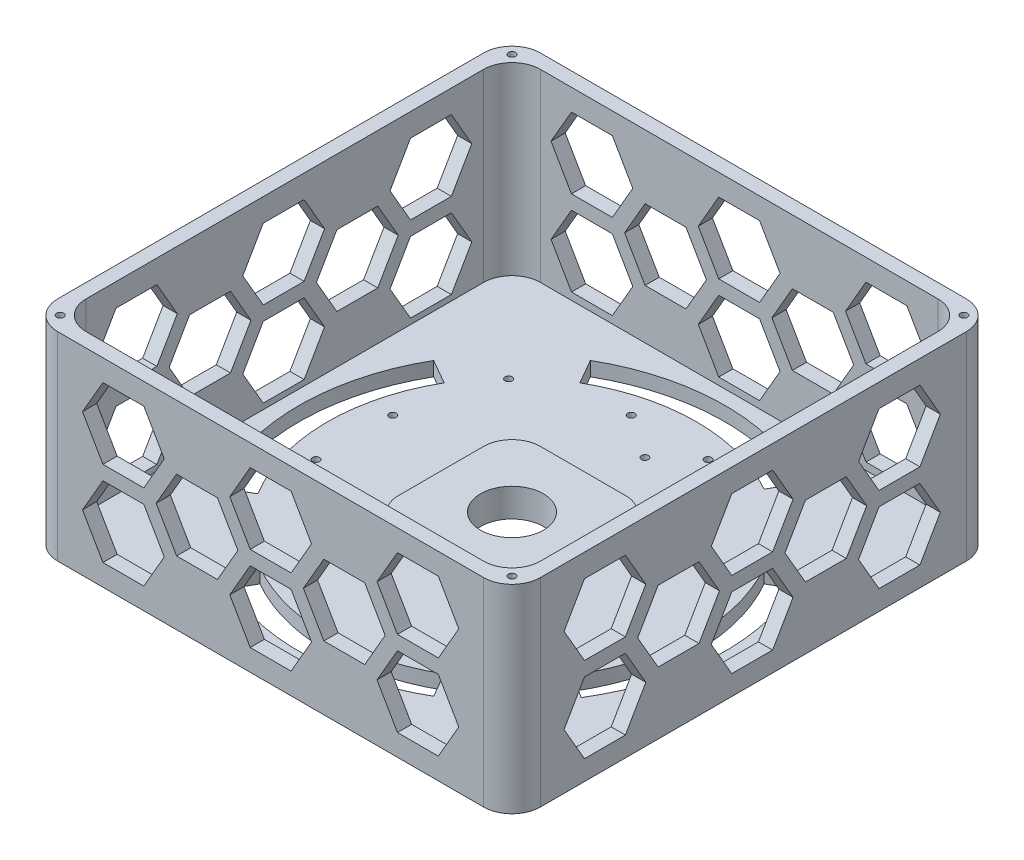
from build123d import *

# Parameters (mm, degrees)
BOSS_EXTRUDE1_DEPTH = 70
CUT_EXTRUDE1_DEPTH  = 65
CUT_EXTRUDE2_DEPTH  = 195
CUT_EXTRUDE4_REACH  = 252.4
LPATTERN1_COUNT     = 2
LPATTERN1_PITCH     = 50
BOSS_EXTRUDE3_DEPTH = 5
CUT_EXTRUDE5_REACH  = 249.79
SKETCH15_R          = 11.1
SKETCH16_R          = 1.25
CUT_EXTRUDE6_DEPTH  = 12
SKETCH17_R          = 1.25
CUT_EXTRUDE7_DEPTH  = 4.5


with BuildPart() as part:
    # Sketch1 → Boss-Extrude1 (new body)
    with BuildSketch(Plane(origin=(0, 0, 0), x_dir=(1, 0, 0), z_dir=(0, 1, 0))):
        with BuildLine():
            Line((10, 0), (160, 0))
            ThreePointArc((160, 0), (167.071067812, 2.928932188), (170, 10))
            Line((170, 10), (170, 160))
            ThreePointArc((170, 160), (167.071067812, 167.071067812), (160, 170))
            Line((160, 170), (10, 170))
            ThreePointArc((10, 170), (2.928932188, 167.071067812), (0, 160))
            Line((0, 160), (0, 10))
            ThreePointArc((0, 10), (2.928932188, 2.928932188), (10, 0))
        make_face()
    extrude(amount=BOSS_EXTRUDE1_DEPTH)

    # Sketch2 → Cut-Extrude1 (cut)
    with BuildSketch(Plane(origin=(0, 70, 0), x_dir=(1, 0, 0), z_dir=(0, 1, 0))):
        with BuildLine():
            Line((15, 5), (155, 5))
            ThreePointArc((155, 5), (162.071067812, 7.928932188), (165, 15))
            Line((165, 15), (165, 155))
            ThreePointArc((165, 155), (162.071067812, 162.071067812), (155, 165))
            Line((155, 165), (15, 165))
            ThreePointArc((15, 165), (7.928932188, 162.071067812), (5, 155))
            Line((5, 155), (5, 15))
            ThreePointArc((5, 15), (7.928932188, 7.928932188), (15, 5))
        make_face()
    extrude(amount=-CUT_EXTRUDE1_DEPTH, mode=Mode.SUBTRACT)

    # Sketch5 → Cut-Extrude2 (cut)
    with BuildSketch(Plane.XY):
        Polygon((47.53971906, 49.97075), (40.33971953, 62.441515), (25.93972047, 62.441515), (18.73972094, 49.97075), (25.93972047, 37.499985), (40.33971953, 37.499985), align=None)
        Polygon((99.39999906, 49.97075), (92.19999953, 62.441515), (77.80000047, 62.441515), (70.60000094, 49.97075), (77.80000047, 37.499985), (92.19999953, 37.499985), align=None)
        Polygon((151.26027906, 49.97075), (144.06027953, 62.441515), (129.66028047, 62.441515), (122.46028094, 49.97075), (129.66028047, 37.499985), (144.06027953, 37.499985), align=None)
        Polygon((99.39999906, 20.02925), (92.19999953, 32.500015), (77.80000047, 32.500015), (70.60000094, 20.02925), (77.80000047, 7.558485), (92.19999953, 7.558485), align=None)
        Polygon((47.53971906, 20.02925), (40.33971953, 32.500015), (25.93972047, 32.500015), (18.73972094, 20.02925), (25.93972047, 7.558485), (40.33971953, 7.558485), align=None)
        Polygon((151.26027906, 20.02925), (144.06027953, 32.500015), (129.66028047, 32.500015), (122.46028094, 20.02925), (129.66028047, 7.558485), (144.06027953, 7.558485), align=None)
        Polygon((73.46985906, 35), (66.26985953, 47.470765), (51.86986047, 47.470765), (44.66986094, 35), (51.86986047, 22.529235), (66.26985953, 22.529235), align=None)
        Polygon((125.33013906, 35), (118.13013953, 47.470765), (103.73014047, 47.470765), (96.53014094, 35), (103.73014047, 22.529235), (118.13013953, 22.529235), align=None)
    extrude(amount=-CUT_EXTRUDE2_DEPTH, mode=Mode.SUBTRACT)

    # Sketch13 → Cut-Extrude4 (cut, up to next)
    with BuildSketch(Plane(origin=(170, 0, 0), x_dir=(0, 0, -1), z_dir=(1, 0, 0)), mode=Mode.PRIVATE) as cut_extrude4_sk1:
        Polygon((47.127845985, 49.408840731), (39.927846455, 61.879605731), (25.527847396, 61.879605731), (18.327847866, 49.408840731), (25.527847396, 36.938075731), (39.927846455, 36.938075731), align=None)
    cut_extrude4_tool1 = extrude(cut_extrude4_sk1.sketch, amount=-CUT_EXTRUDE4_REACH, mode=Mode.PRIVATE) & part.part
    # Sketch13 → Cut-Extrude4 (cut, up to next)
    with BuildSketch(Plane(origin=(170, 0, 0), x_dir=(0, 0, -1), z_dir=(1, 0, 0)), mode=Mode.PRIVATE) as cut_extrude4_sk2:
        Polygon((98.988125985, 49.408840731), (91.788126455, 61.879605731), (77.388127396, 61.879605731), (70.188127866, 49.408840731), (77.388127396, 36.938075731), (91.788126455, 36.938075731), align=None)
    cut_extrude4_tool2 = extrude(cut_extrude4_sk2.sketch, amount=-CUT_EXTRUDE4_REACH, mode=Mode.PRIVATE) & part.part
    # Sketch13 → Cut-Extrude4 (cut, up to next)
    with BuildSketch(Plane(origin=(170, 0, 0), x_dir=(0, 0, -1), z_dir=(1, 0, 0)), mode=Mode.PRIVATE) as cut_extrude4_sk3:
        Polygon((150.848405985, 49.408840731), (143.648406455, 61.879605731), (129.248407396, 61.879605731), (122.048407866, 49.408840731), (129.248407396, 36.938075731), (143.648406455, 36.938075731), align=None)
    cut_extrude4_tool3 = extrude(cut_extrude4_sk3.sketch, amount=-CUT_EXTRUDE4_REACH, mode=Mode.PRIVATE) & part.part
    # Sketch13 → Cut-Extrude4 (cut, up to next)
    with BuildSketch(Plane(origin=(170, 0, 0), x_dir=(0, 0, -1), z_dir=(1, 0, 0)), mode=Mode.PRIVATE) as cut_extrude4_sk4:
        Polygon((98.988125985, 19.467340731), (91.788126455, 31.938105731), (77.388127396, 31.938105731), (70.188127866, 19.467340731), (77.388127396, 6.996575731), (91.788126455, 6.996575731), align=None)
    cut_extrude4_tool4 = extrude(cut_extrude4_sk4.sketch, amount=-CUT_EXTRUDE4_REACH, mode=Mode.PRIVATE) & part.part
    # Sketch13 → Cut-Extrude4 (cut, up to next)
    with BuildSketch(Plane(origin=(170, 0, 0), x_dir=(0, 0, -1), z_dir=(1, 0, 0)), mode=Mode.PRIVATE) as cut_extrude4_sk5:
        Polygon((47.127845985, 19.467340731), (39.927846455, 31.938105731), (25.527847396, 31.938105731), (18.327847866, 19.467340731), (25.527847396, 6.996575731), (39.927846455, 6.996575731), align=None)
    cut_extrude4_tool5 = extrude(cut_extrude4_sk5.sketch, amount=-CUT_EXTRUDE4_REACH, mode=Mode.PRIVATE) & part.part
    # Sketch13 → Cut-Extrude4 (cut, up to next)
    with BuildSketch(Plane(origin=(170, 0, 0), x_dir=(0, 0, -1), z_dir=(1, 0, 0)), mode=Mode.PRIVATE) as cut_extrude4_sk6:
        Polygon((150.848405985, 19.467340731), (143.648406455, 31.938105731), (129.248407396, 31.938105731), (122.048407866, 19.467340731), (129.248407396, 6.996575731), (143.648406455, 6.996575731), align=None)
    cut_extrude4_tool6 = extrude(cut_extrude4_sk6.sketch, amount=-CUT_EXTRUDE4_REACH, mode=Mode.PRIVATE) & part.part
    # Sketch13 → Cut-Extrude4 (cut, up to next)
    with BuildSketch(Plane(origin=(170, 0, 0), x_dir=(0, 0, -1), z_dir=(1, 0, 0)), mode=Mode.PRIVATE) as cut_extrude4_sk7:
        Polygon((73.057985985, 34.438090731), (65.857986455, 46.908855731), (51.457987396, 46.908855731), (44.257987866, 34.438090731), (51.457987396, 21.967325731), (65.857986455, 21.967325731), align=None)
    cut_extrude4_tool7 = extrude(cut_extrude4_sk7.sketch, amount=-CUT_EXTRUDE4_REACH, mode=Mode.PRIVATE) & part.part
    # Sketch13 → Cut-Extrude4 (cut, up to next)
    with BuildSketch(Plane(origin=(170, 0, 0), x_dir=(0, 0, -1), z_dir=(1, 0, 0)), mode=Mode.PRIVATE) as cut_extrude4_sk8:
        Polygon((124.918265985, 34.438090731), (117.718266455, 46.908855731), (103.318267396, 46.908855731), (96.118267866, 34.438090731), (103.318267396, 21.967325731), (117.718266455, 21.967325731), align=None)
    cut_extrude4_tool8 = extrude(cut_extrude4_sk8.sketch, amount=-CUT_EXTRUDE4_REACH, mode=Mode.PRIVATE) & part.part
    cut_extrude4_1 = cut_extrude4_tool1.solids().sort_by_distance((170, 49.408841, -32.727847))[0]
    add(cut_extrude4_1, mode=Mode.SUBTRACT)
    cut_extrude4_2 = cut_extrude4_tool2.solids().sort_by_distance((170, 49.408841, -84.588127))[0]
    add(cut_extrude4_2, mode=Mode.SUBTRACT)
    cut_extrude4_3 = cut_extrude4_tool3.solids().sort_by_distance((170, 49.408841, -136.448407))[0]
    add(cut_extrude4_3, mode=Mode.SUBTRACT)
    cut_extrude4_4 = cut_extrude4_tool4.solids().sort_by_distance((170, 19.467341, -84.588127))[0]
    add(cut_extrude4_4, mode=Mode.SUBTRACT)
    cut_extrude4_5 = cut_extrude4_tool5.solids().sort_by_distance((170, 19.467341, -32.727847))[0]
    add(cut_extrude4_5, mode=Mode.SUBTRACT)
    cut_extrude4_6 = cut_extrude4_tool6.solids().sort_by_distance((170, 19.467341, -136.448407))[0]
    add(cut_extrude4_6, mode=Mode.SUBTRACT)
    cut_extrude4_7 = cut_extrude4_tool7.solids().sort_by_distance((170, 34.438091, -58.657987))[0]
    add(cut_extrude4_7, mode=Mode.SUBTRACT)
    cut_extrude4_8 = cut_extrude4_tool8.solids().sort_by_distance((170, 34.438091, -110.518267))[0]
    add(cut_extrude4_8, mode=Mode.SUBTRACT)
    cut_extrude4 = cut_extrude4_1 + cut_extrude4_2 + cut_extrude4_3 + cut_extrude4_4 + cut_extrude4_5 + cut_extrude4_6 + cut_extrude4_7 + cut_extrude4_8  # Cut-Extrude4 as one shape, for the pattern or mirror that repeats it

    # LPattern1: Cut-Extrude4; each copy of Cut-Extrude4 runs up to whatever stops it at its own place
    lpattern1_before = part.part  # the part as the pattern finds it: every copy runs up to it
    lpattern1_cut_extrude4_long1 = extrude(cut_extrude4_sk1.sketch, amount=-CUT_EXTRUDE4_REACH, mode=Mode.PRIVATE)
    lpattern1_cut_extrude4_long2 = extrude(cut_extrude4_sk2.sketch, amount=-CUT_EXTRUDE4_REACH, mode=Mode.PRIVATE)
    lpattern1_cut_extrude4_long3 = extrude(cut_extrude4_sk3.sketch, amount=-CUT_EXTRUDE4_REACH, mode=Mode.PRIVATE)
    lpattern1_cut_extrude4_long4 = extrude(cut_extrude4_sk4.sketch, amount=-CUT_EXTRUDE4_REACH, mode=Mode.PRIVATE)
    lpattern1_cut_extrude4_long5 = extrude(cut_extrude4_sk5.sketch, amount=-CUT_EXTRUDE4_REACH, mode=Mode.PRIVATE)
    lpattern1_cut_extrude4_long6 = extrude(cut_extrude4_sk6.sketch, amount=-CUT_EXTRUDE4_REACH, mode=Mode.PRIVATE)
    lpattern1_cut_extrude4_long7 = extrude(cut_extrude4_sk7.sketch, amount=-CUT_EXTRUDE4_REACH, mode=Mode.PRIVATE)
    lpattern1_cut_extrude4_long8 = extrude(cut_extrude4_sk8.sketch, amount=-CUT_EXTRUDE4_REACH, mode=Mode.PRIVATE)
    lpattern1_cut_extrude4_tool1_1 = lpattern1_cut_extrude4_long1.moved(Location(Vector(-1, 0, 0) * (1 * LPATTERN1_PITCH))) & lpattern1_before
    add(lpattern1_cut_extrude4_tool1_1.solids().sort_by_distance((120, 49.408841, -32.727847))[0], mode=Mode.SUBTRACT)
    lpattern1_cut_extrude4_tool2_1 = lpattern1_cut_extrude4_long2.moved(Location(Vector(-1, 0, 0) * (1 * LPATTERN1_PITCH))) & lpattern1_before
    add(lpattern1_cut_extrude4_tool2_1.solids().sort_by_distance((120, 49.408841, -84.588127))[0], mode=Mode.SUBTRACT)
    lpattern1_cut_extrude4_tool3_1 = lpattern1_cut_extrude4_long3.moved(Location(Vector(-1, 0, 0) * (1 * LPATTERN1_PITCH))) & lpattern1_before
    add(lpattern1_cut_extrude4_tool3_1.solids().sort_by_distance((120, 49.408841, -136.448407))[0], mode=Mode.SUBTRACT)
    lpattern1_cut_extrude4_tool4_1 = lpattern1_cut_extrude4_long4.moved(Location(Vector(-1, 0, 0) * (1 * LPATTERN1_PITCH))) & lpattern1_before
    add(lpattern1_cut_extrude4_tool4_1.solids().sort_by_distance((120, 19.467341, -84.588127))[0], mode=Mode.SUBTRACT)
    lpattern1_cut_extrude4_tool5_1 = lpattern1_cut_extrude4_long5.moved(Location(Vector(-1, 0, 0) * (1 * LPATTERN1_PITCH))) & lpattern1_before
    add(lpattern1_cut_extrude4_tool5_1.solids().sort_by_distance((120, 19.467341, -32.727847))[0], mode=Mode.SUBTRACT)
    lpattern1_cut_extrude4_tool6_1 = lpattern1_cut_extrude4_long6.moved(Location(Vector(-1, 0, 0) * (1 * LPATTERN1_PITCH))) & lpattern1_before
    add(lpattern1_cut_extrude4_tool6_1.solids().sort_by_distance((120, 19.467341, -136.448407))[0], mode=Mode.SUBTRACT)
    lpattern1_cut_extrude4_tool7_1 = lpattern1_cut_extrude4_long7.moved(Location(Vector(-1, 0, 0) * (1 * LPATTERN1_PITCH))) & lpattern1_before
    add(lpattern1_cut_extrude4_tool7_1.solids().sort_by_distance((120, 34.438091, -58.657987))[0], mode=Mode.SUBTRACT)
    lpattern1_cut_extrude4_tool8_1 = lpattern1_cut_extrude4_long8.moved(Location(Vector(-1, 0, 0) * (1 * LPATTERN1_PITCH))) & lpattern1_before
    add(lpattern1_cut_extrude4_tool8_1.solids().sort_by_distance((120, 34.438091, -110.518267))[0], mode=Mode.SUBTRACT)

    # Sketch14 → Boss-Extrude3 (add)
    with BuildSketch(Plane(origin=(0, 5, 0), x_dir=(1, 0, 0), z_dir=(0, 1, 0))):
        with BuildLine():
            Line((85, 60), (100, 60))
            ThreePointArc((100, 60), (107.071067812, 62.928932188), (110, 70))
            Line((110, 70), (110, 100))
            ThreePointArc((110, 100), (107.071067812, 107.071067812), (100, 110))
            Line((100, 110), (70, 110))
            ThreePointArc((70, 110), (62.928932188, 107.071067812), (60, 100))
            Line((60, 100), (60, 70))
            ThreePointArc((60, 70), (62.928932188, 62.928932188), (70, 60))
            Line((70, 60), (85, 60))
        make_face()
    extrude(amount=BOSS_EXTRUDE3_DEPTH)

    # Sketch15 → Cut-Extrude5 (cut, up to next)
    with BuildSketch(Plane(origin=(0, 10, 0), x_dir=(1, 0, 0), z_dir=(0, 1, 0)), mode=Mode.PRIVATE) as cut_extrude5_sk1:
        with Locations(Location((85, 85, 0), (0, 0, 270))):
            Circle(SKETCH15_R)
    cut_extrude5_tool1 = extrude(cut_extrude5_sk1.sketch, amount=-CUT_EXTRUDE5_REACH, mode=Mode.PRIVATE) & part.part
    # Sketch15 → Cut-Extrude5 (cut, up to next)
    with BuildSketch(Plane(origin=(0, 10, 0), x_dir=(1, 0, 0), z_dir=(0, 1, 0)), mode=Mode.PRIVATE) as cut_extrude5_sk2:
        with BuildLine():
            Line((52.572302648, 28.666666667), (47.583426132, 20))
            ThreePointArc((47.583426132, 20), (85, 10), (122.416573868, 20))
            Line((122.416573868, 20), (117.427697352, 28.666666667))
            ThreePointArc((117.427697352, 28.666666667), (85, 20), (52.572302648, 28.666666667))
        make_face()
    cut_extrude5_tool2 = extrude(cut_extrude5_sk2.sketch, amount=-CUT_EXTRUDE5_REACH, mode=Mode.PRIVATE) & part.part
    # Sketch15 → Cut-Extrude5 (cut, up to next)
    with BuildSketch(Plane(origin=(0, 10, 0), x_dir=(1, 0, 0), z_dir=(0, 1, 0)), mode=Mode.PRIVATE) as cut_extrude5_sk3:
        with BuildLine():
            Line((140.300425317, 50.840624131), (148.808183058, 45.585335536))
            ThreePointArc((148.808183058, 45.585335536), (159.990978135, 83.836729432), (150, 122.416573868))
            Line((150, 122.416573868), (141.333333333, 117.427697352))
            ThreePointArc((141.333333333, 117.427697352), (149.99218105, 83.991832175), (140.300425317, 50.840624131))
        make_face()
    cut_extrude5_tool3 = extrude(cut_extrude5_sk3.sketch, amount=-CUT_EXTRUDE5_REACH, mode=Mode.PRIVATE) & part.part
    # Sketch15 → Cut-Extrude5 (cut, up to next)
    with BuildSketch(Plane(origin=(0, 10, 0), x_dir=(1, 0, 0), z_dir=(0, 1, 0)), mode=Mode.PRIVATE) as cut_extrude5_sk4:
        with BuildLine():
            Line((47.583426132, 150), (52.572302648, 141.333333333))
            ThreePointArc((52.572302648, 141.333333333), (85, 150), (117.427697352, 141.333333333))
            Line((117.427697352, 141.333333333), (122.416573868, 150))
            ThreePointArc((122.416573868, 150), (85, 160), (47.583426132, 150))
        make_face()
    cut_extrude5_tool4 = extrude(cut_extrude5_sk4.sketch, amount=-CUT_EXTRUDE5_REACH, mode=Mode.PRIVATE) & part.part
    cut_extrude5_1 = cut_extrude5_tool1.solids().sort_by_distance((85, 10, -85))[0]
    add(cut_extrude5_1, mode=Mode.SUBTRACT)
    cut_extrude5_2 = cut_extrude5_tool2.solids().sort_by_distance((85, 10, -18.025973))[0]
    add(cut_extrude5_2, mode=Mode.SUBTRACT)
    cut_extrude5_3 = cut_extrude5_tool3.solids().sort_by_distance((151.77917, 10, -83.964112))[0]
    add(cut_extrude5_3, mode=Mode.SUBTRACT)
    cut_extrude5_4 = cut_extrude5_tool4.solids().sort_by_distance((85, 10, -151.974027))[0]
    add(cut_extrude5_4, mode=Mode.SUBTRACT)
    cut_extrude5 = cut_extrude5_1 + cut_extrude5_2 + cut_extrude5_3 + cut_extrude5_4  # Cut-Extrude5 as one shape, for the pattern or mirror that repeats it

    # Mirror1: Cut-Extrude5 across plane
    add(cut_extrude5.mirror(Plane(origin=(85, 0, 0), x_dir=(0, 0, 1), z_dir=(1, 0, 0))), mode=Mode.SUBTRACT)

    # Sketch16 → Cut-Extrude6 (cut)
    with BuildSketch(Plane(origin=(0, 70, 0), x_dir=(1, 0, 0), z_dir=(0, 1, 0))):
        with Locations(Location((5.429, 5.429, 0), (0, 0, 270))):
            Circle(SKETCH16_R)
        with Locations(Location((164.571, 5.429, 0), (0, 0, 270))):
            Circle(SKETCH16_R)
        with Locations(Location((5.429, 164.571, 0), (0, 0, 270))):
            Circle(SKETCH16_R)
        with Locations(Location((164.571, 164.571, 0), (0, 0, 270))):
            Circle(SKETCH16_R)
    extrude(amount=-CUT_EXTRUDE6_DEPTH, mode=Mode.SUBTRACT)

    # Sketch17 → Cut-Extrude7 (cut)
    with BuildSketch(Plane(origin=(0, 5, 0), x_dir=(1, 0, 0), z_dir=(0, 1, 0))):
        with Locations(Location((140.5, 98.5, 0), (0, 0, 270))):
            Circle(SKETCH17_R)
        with Locations(Location((140.5, 71.5, 0), (0, 0, 270))):
            Circle(SKETCH17_R)
        with Locations(Location((71.5, 140.5, 0), (0, 0, 270))):
            Circle(SKETCH17_R)
        with Locations(Location((98.5, 140.5, 0), (0, 0, 270))):
            Circle(SKETCH17_R)
        with Locations(Location((29.5, 71.5, 0), (0, 0, 270))):
            Circle(SKETCH17_R)
        with Locations(Location((29.5, 98.5, 0), (0, 0, 270))):
            Circle(SKETCH17_R)
        with Locations(Location((98.5, 29.5, 0), (0, 0, 270))):
            Circle(SKETCH17_R)
        with Locations(Location((71.5, 29.5, 0), (0, 0, 270))):
            Circle(SKETCH17_R)
        with Locations(Location((38.8, 130, 0), (0, 0, 270))):
            Circle(SKETCH17_R)
        with Locations(Location((38.8, 40, 0), (0, 0, 270))):
            Circle(SKETCH17_R)
        with Locations(Location((86.8, 130, 0), (0, 0, 270))):
            Circle(SKETCH17_R)
        with Locations(Location((86.8, 40, 0), (0, 0, 270))):
            Circle(SKETCH17_R)
    extrude(amount=-CUT_EXTRUDE7_DEPTH, mode=Mode.SUBTRACT)


solid = part.part
